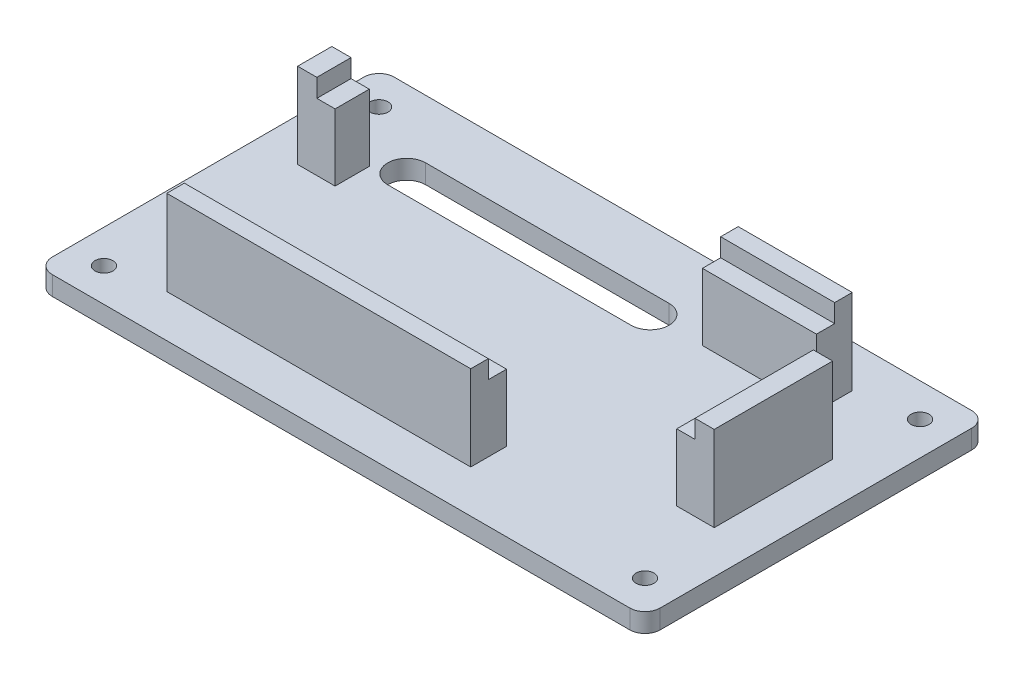
from build123d import *

# Parameters (mm, degrees)
SKETCH1_W               = 101.6
SKETCH1_H               = 57.15
BOSS_EXTRUDE1_DEPTH     = 3.175
SKETCH10_R              = 1.5
CUT_EXTRUDE3_DEPTH      = 59.371664787
FILLET1_R               = 2.54
CUT_EXTRUDE4_DEPTH      = 59.371664787
CUT_EXTRUDE4_DEPTH_BACK = 59.371664787
SKETCH12_R              = 2.794
BOSS_EXTRUDE3_DEPTH     = 1.397
SKETCH13_R              = 2.794
BOSS_EXTRUDE4_DEPTH     = 1.397
FILLET4_R               = 1
SKETCH14_W              = 50.8
SKETCH14_H              = 5.9817
SKETCH14_W_2            = 19.058479039
SKETCH14_W_3            = 6.2611
SKETCH14_H_2            = 19.7866
SKETCH14_H_3            = 5.715
BOSS_EXTRUDE5_DEPTH     = 11.176
SKETCH15_W              = 3.2131
SKETCH15_H              = 19.7866
SKETCH15_W_2            = 19.058479039
SKETCH15_H_2            = 2.9337
SKETCH15_H_3            = 5.715
SKETCH15_W_3            = 50.8
BOSS_EXTRUDE6_DEPTH     = 3.048


with BuildPart() as part:
    # Sketch1 → Boss-Extrude1 (new body)
    with BuildSketch(Plane(origin=(0, 0, 0), x_dir=(1, 0, 0), z_dir=(0, 1, 0))):
        Rectangle(SKETCH1_W, SKETCH1_H)
    extrude(amount=BOSS_EXTRUDE1_DEPTH)

    # Sketch10 → Cut-Extrude3 (cut, through all)
    with BuildSketch(Plane(origin=(0, 3.175, 0), x_dir=(1, 0, 0), z_dir=(0, 1, 0))):
        with Locations(Location((-45.212, -22.987, 0), (0, 0, 270))):
            Circle(SKETCH10_R)
        with Locations(Location((45.212, 22.987, 0), (0, 0, 270))):
            Circle(SKETCH10_R)
        with Locations(Location((-45.212, 22.987, 0), (0, 0, 270))):
            Circle(SKETCH10_R)
        with Locations(Location((45.212, -22.987, 0), (0, 0, 270))):
            Circle(SKETCH10_R)
    extrude(amount=-CUT_EXTRUDE3_DEPTH, mode=Mode.SUBTRACT)

    # Fillet1
    fillet1_edges = [part.edges().sort_by_distance(p)[0] for p in [
        (-50.8, 1.5875, -28.575),
        (50.8, 1.5875, -28.575),
        (50.8, 1.5875, 28.575),
        (-50.8, 1.5875, 28.575),
    ]]
    fillet(fillet1_edges, radius=FILLET1_R)

    # Sketch11 → Cut-Extrude4 (cut, two sides: drawn at the far end of the back side and taken through both)
    with BuildSketch(Plane(origin=(0, 3.175, 0), x_dir=(1, 0, 0), z_dir=(0, 1, 0)).offset(-CUT_EXTRUDE4_DEPTH_BACK)):
        with BuildLine():
            Line((-33.224345588, 18.800272814), (7.451171928, 18.800272814))
            ThreePointArc((7.451171928, 18.800272814), (10.626171928, 15.625272814), (7.451171928, 12.450272814))
            Line((7.451171928, 12.450272814), (-33.224345588, 12.450272814))
            ThreePointArc((-33.224345588, 12.450272814), (-36.399345588, 15.625272814), (-33.224345588, 18.800272814))
        make_face()
    extrude(amount=CUT_EXTRUDE4_DEPTH + CUT_EXTRUDE4_DEPTH_BACK, mode=Mode.SUBTRACT)

    # Sketch12 → Boss-Extrude3 (add, symmetric)
    with BuildSketch(Plane(origin=(2.9972, 0, 0), x_dir=(0, 0, -1), z_dir=(1, 0, 0))):
        with BuildLine():
            Line((-7.5057, 0), (7.5057, 0))
            Line((7.5057, 0), (10.6807, 0))
            Line((10.6807, 0), (7.5057, -8.0518))
            ThreePointArc((7.5057, -8.0518), (0, -15.5575), (-7.5057, -8.0518))
            Line((-7.5057, -8.0518), (-10.6807, 0))
            Line((-10.6807, 0), (-7.5057, 0))
        make_face()
        with Locations((0, -8.0518)):
            Circle(SKETCH12_R, mode=Mode.SUBTRACT)
    extrude(amount=BOSS_EXTRUDE3_DEPTH, both=True)

    # Sketch13 → Boss-Extrude4 (add, symmetric)
    with BuildSketch(Plane(origin=(-2.9972, 0, 0), x_dir=(0, 0, -1), z_dir=(1, 0, 0))):
        with BuildLine():
            Line((-7.5057, 0), (7.5057, 0))
            Line((7.5057, 0), (10.6807, 0))
            Line((10.6807, 0), (7.5057, -8.0518))
            ThreePointArc((7.5057, -8.0518), (0, -15.5575), (-7.5057, -8.0518))
            Line((-7.5057, -8.0518), (-10.6807, 0))
            Line((-10.6807, 0), (-7.5057, 0))
        make_face()
        with Locations((0, -8.0518)):
            Circle(SKETCH13_R, mode=Mode.SUBTRACT)
    extrude(amount=BOSS_EXTRUDE4_DEPTH, both=True)

    # Fillet4
    fillet4_edges = [part.edges().sort_by_distance(p)[0] for p in [
        (4.3942, 0, 0),
        (2.9972, -8.0518, 7.5057),
        (2.9972, -8.0518, -7.5057),
        (1.6002, 0, 0),
        (2.9972, 0, -10.6807),
        (2.9972, 0, 10.6807),
        (-1.6002, 0, 0),
        (-2.9972, 0, 10.6807),
        (-2.9972, -8.0518, 7.5057),
        (-2.9972, -8.0518, -7.5057),
        (-4.3942, 0, 0),
        (-2.9972, 0, -10.6807),
    ]]
    fillet(fillet4_edges, radius=FILLET4_R)

    # Sketch14 → Boss-Extrude5 (add)
    with BuildSketch(Plane(origin=(0, 3.175, 0), x_dir=(1, 0, 0), z_dir=(0, 1, 0))):
        with Locations((-10.8331, -18.47215)):
            Rectangle(SKETCH14_W, SKETCH14_H)
        with Locations((25.870411448, 18.47215)):
            Rectangle(SKETCH14_W_2, SKETCH14_H)
        with Locations((40.55745, 0)):
            Rectangle(SKETCH14_W_3, SKETCH14_H_2)
        with Locations((-40.55745, 10.7188)):
            Rectangle(SKETCH14_W_3, SKETCH14_H_3)
    extrude(amount=BOSS_EXTRUDE5_DEPTH)

    # Sketch15 → Boss-Extrude6 (add)
    with BuildSketch(Plane(origin=(0, 14.351, 0), x_dir=(1, 0, 0), z_dir=(0, 1, 0))):
        with Locations((42.08145, 0)):
            Rectangle(SKETCH15_W, SKETCH15_H)
        with Locations((25.870411448, 19.99615)):
            Rectangle(SKETCH15_W_2, SKETCH15_H_2)
        with Locations((-42.08145, 10.7188)):
            Rectangle(SKETCH15_W, SKETCH15_H_3)
        with Locations((-10.8331, -19.99615)):
            Rectangle(SKETCH15_W_3, SKETCH15_H_2)
    extrude(amount=BOSS_EXTRUDE6_DEPTH)


solid = part.part
